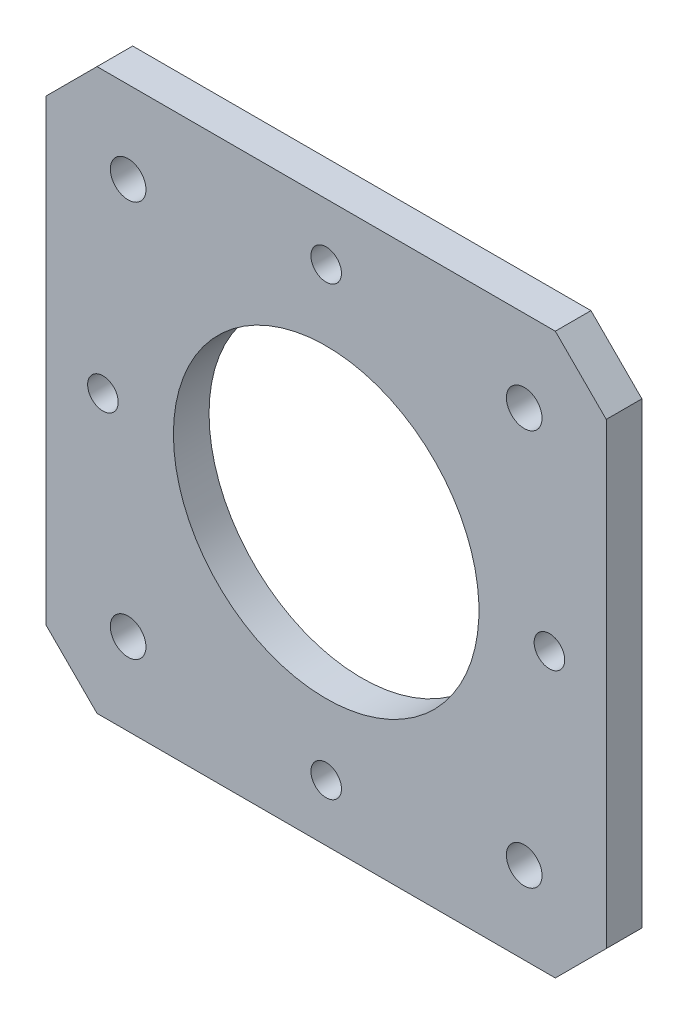
from build123d import *

# Parameters (mm, degrees)
SKETCH1_W           = 55
SKETCH1_H           = 55
SKETCH1_R           = 1.75
BOSS_EXTRUDE1_DEPTH = 3.5
SKETCH2_R           = 15
CUT_EXTRUDE1_DEPTH  = 40.048047326
SKETCH3_R           = 1.5
CUT_EXTRUDE2_DEPTH  = 40.048047326
CHAMFER1_SIZE       = 5


with BuildPart() as part:
    # Sketch1 → Boss-Extrude1 (new body)
    with BuildSketch(Plane.XY):
        Rectangle(SKETCH1_W, SKETCH1_H)
        with Locations((19.445436483, 19.445436483)):
            Circle(SKETCH1_R, mode=Mode.SUBTRACT)
        with Locations((-19.445436483, 19.445436483)):
            Circle(SKETCH1_R, mode=Mode.SUBTRACT)
        with Locations((-19.445436483, -19.445436483)):
            Circle(SKETCH1_R, mode=Mode.SUBTRACT)
        with Locations((19.445436483, -19.445436483)):
            Circle(SKETCH1_R, mode=Mode.SUBTRACT)
    extrude(amount=BOSS_EXTRUDE1_DEPTH)

    # Sketch2 → Cut-Extrude1 (cut, through all)
    with BuildSketch(Plane(origin=(0, 0, 0), x_dir=(-1, 0, 0), z_dir=(0, 0, -1))):
        Circle(SKETCH2_R)
    extrude(amount=-CUT_EXTRUDE1_DEPTH, mode=Mode.SUBTRACT)

    # Sketch3 → Cut-Extrude2 (cut, through all)
    with BuildSketch(Plane(origin=(0, 0, 0), x_dir=(-1, 0, 0), z_dir=(0, 0, -1))):
        with Locations((0, 21.920310217)):
            Circle(SKETCH3_R)
        with Locations((21.920310217, 0)):
            Circle(SKETCH3_R)
        with Locations((0, -21.920310217)):
            Circle(SKETCH3_R)
        with Locations((-21.920310217, 0)):
            Circle(SKETCH3_R)
    extrude(amount=-CUT_EXTRUDE2_DEPTH, mode=Mode.SUBTRACT)

    # Chamfer1
    chamfer1_edges = [part.edges().sort_by_distance(p)[0] for p in [
        (27.5, -27.5, 1.75),
        (-27.5, -27.5, 1.75),
        (-27.5, 27.5, 1.75),
        (27.5, 27.5, 1.75),
    ]]
    chamfer(chamfer1_edges, length=CHAMFER1_SIZE)


solid = part.part
